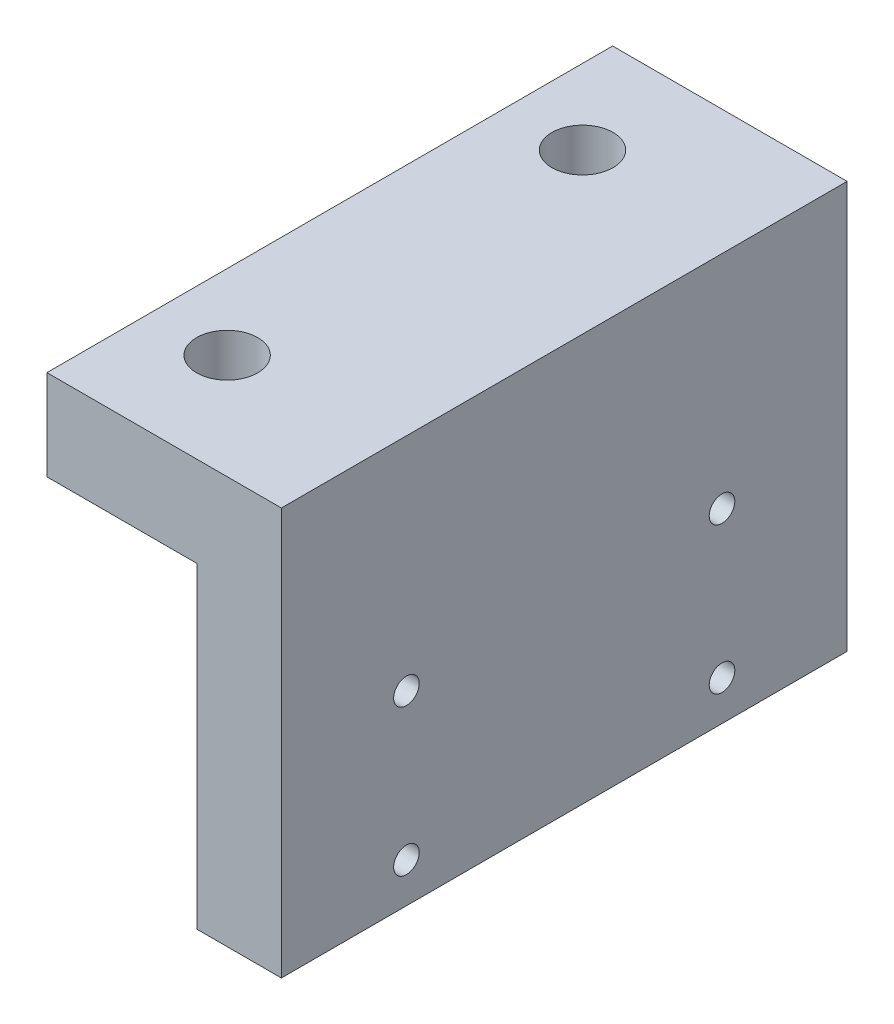
from build123d import *

# Parameters (mm, degrees)
MAINBODY_EXTRUDE_START                    = 293.6
MAINBODY_EXTRUDE_DEPTH                    = 39.8
BOLSTEREDPLINTH_EXTRUDE_START             = -3.4
BOLSTEREDPLINTH_EXTRUDE_DEPTH             = 39.8
PROXIMALMOUNTHOLESCREWHEADLANDS_CUT_START = -6.35
PROXIMALMOUNTHOLESCREWHEADLANDS_CUT_DEPTH = 3.175
PROXIMALMOUNTSCREWHOLES_SKETCH_R          = 2.15
PROXIMALMOUNTHOLES_CUT_DEPTH              = 335.794235324
LIMITSWITCHMOUNTHOLES_HOLEWIZARD_D        = 1.8


with BuildPart() as part:
    # projectionZ_sketch → mainBody_extrude (new body)
    with BuildSketch(Plane.XY.offset(MAINBODY_EXTRUDE_START)):
        Polygon((3.175, -28.6375), (0, -28.6375), (0, -3.175), (-10.56, -3.175), (-10.56, 0), (3.175, 0), align=None)
    extrude(amount=MAINBODY_EXTRUDE_DEPTH)

    # bolsteredPlinthProjectionZ_sketch → bolsteredPlinth_extrude (add)
    with BuildSketch(Plane.XY.offset(297).offset(BOLSTEREDPLINTH_EXTRUDE_START)):
        Polygon((-10.56, 0), (5.935, 0), (5.935, -28.6375), (3.175, -28.6375), (0, -6.35), (-10.56, -6.35), align=None)
    extrude(amount=BOLSTEREDPLINTH_EXTRUDE_DEPTH)

    # proximalMountScrewHeadLands_sketch → proximalMountHoleScrewHeadLands_cut (cut)
    with BuildSketch(Plane(origin=(0, 0, 0), x_dir=(1, 0, 0), z_dir=(0, 1, 0)).offset(PROXIMALMOUNTHOLESCREWHEADLANDS_CUT_START)):
        with BuildLine():
            Line((-10.56, -331.280000019), (-5.28, -331.280000019))
            ThreePointArc((-5.28, -331.280000019), (0, -326.000000019), (-5.28, -320.720000019))
            Line((-5.28, -320.720000019), (-10.56, -320.720000019))
            Line((-10.56, -320.720000019), (-10.56, -331.280000019))
        make_face()
        with BuildLine():
            Line((-10.56, -306.279999981), (-5.28, -306.279999981))
            ThreePointArc((-5.28, -306.279999981), (0, -300.999999981), (-5.28, -295.719999981))
            Line((-5.28, -295.719999981), (-10.56, -295.719999981))
            Line((-10.56, -295.719999981), (-10.56, -306.279999981))
        make_face()
    extrude(amount=PROXIMALMOUNTHOLESCREWHEADLANDS_CUT_DEPTH, mode=Mode.SUBTRACT)

    # proximalMountScrewHoles_sketch → proximalMountHoles_cut (cut, through all)
    with BuildSketch(Plane(origin=(0, 0, 0), x_dir=(1, 0, 0), z_dir=(0, 1, 0))):
        with Locations(Location((-5.28, -326.000000019, 0), (0, 0, 270))):
            Circle(PROXIMALMOUNTSCREWHOLES_SKETCH_R)
        with Locations(Location((-5.28, -300.999999981, 0), (0, 0, 270))):
            Circle(PROXIMALMOUNTSCREWHOLES_SKETCH_R)
    extrude(amount=-PROXIMALMOUNTHOLES_CUT_DEPTH, mode=Mode.SUBTRACT)

    # limitSwitchMountHoles_holeWizard (through all)
    with Locations(Plane(origin=(0, 0, 0), x_dir=(0, 0, -1), z_dir=(-1, 0, 0))):
        with Locations((-302.4, 25.8375), (-302.4, 15.5375), (-324.6, 15.5375), (-324.6, 25.8375)):
            Hole(LIMITSWITCHMOUNTHOLES_HOLEWIZARD_D / 2)


solid = part.part
